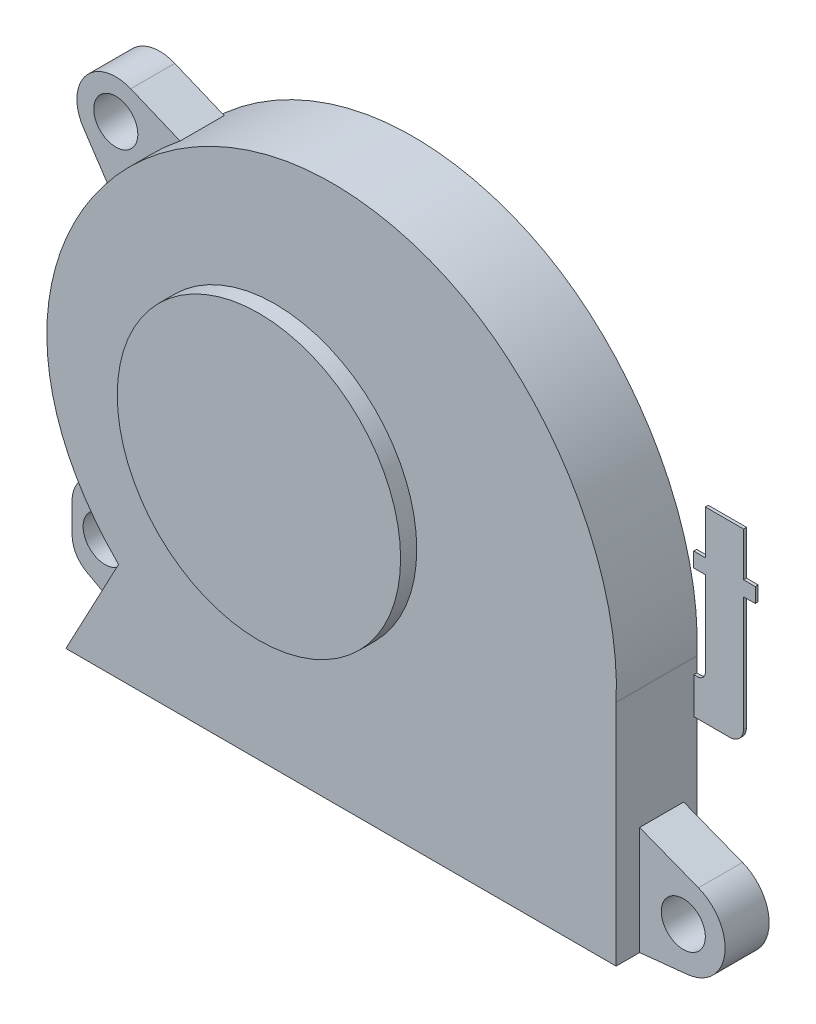
from build123d import *

# Parameters (mm, degrees)
SKIZZE1_R                       = 9.65
AUFSATZ_LINEAR_AUSTRAGEN1_DEPTH = 5.5
SKIZZE1_3_R                     = 9.65
AUFSATZ_LINEAR_AUSTRAGEN2_DEPTH = 6.6
AUFSATZ_LINEAR_START            = 0.9
SKIZZE1_5_R                     = 1.5
AUFSATZ_LINEAR_AUSTRAGEN3_DEPTH = 3
AUFSATZ_LINEAR_AUSTRAGEN4_DEPTH = 0.2


with BuildPart() as part:
    # Skizze1 → Aufsatz-Linear austragen1 (new body)
    with BuildSketch(Plane.XY):
        with BuildLine():
            Line((-14.24879669, -17.8), (23.22989124, -17.8))
            Line((23.22989124, -17.8), (23.22989124, -2.247542747))
            add(Edge.make_bspline(
                [(23.22989124, -2.247542747), (23.570505731, 5.01843493), (17.435920317, 16.509432663), (2.315543688, 19.773891452), (-13.917413027, 13.221960429), (-19.306383662, -2.33852969), (-10.663184769, -11.056444767)],
                knots=[0, 0, 0, 0, 0.303535836, 0.457029394, 0.601755461, 1, 1, 1, 1], degree=3))
            Line((-10.663184769, -11.056444767), (-14.24879669, -17.8))
        make_face()
        Circle(SKIZZE1_R, mode=Mode.SUBTRACT)
    extrude(amount=AUFSATZ_LINEAR_AUSTRAGEN1_DEPTH)

    # Skizze1<3> → Aufsatz-Linear austragen2 (add)
    with BuildSketch(Plane.XY):
        Circle(SKIZZE1_3_R)
    extrude(amount=AUFSATZ_LINEAR_AUSTRAGEN2_DEPTH)

    # Skizze1<5> → Aufsatz-Linear austragen3 (add)
    # profile 1 of 3: a face of its own
    with BuildSketch(Plane.XY.offset(AUFSATZ_LINEAR_START)):
        with BuildLine():
            Line((23.22989124, -10.418487336), (23.22989124, -17.8))
            Line((23.22989124, -17.8), (26.500672864, -17.459737855))
            ThreePointArc((26.500672864, -17.459737855), (29.026515796, -15.008489952), (27.237700891, -11.977212988))
            Line((27.237700891, -11.977212988), (23.22989124, -10.418487336))
        make_face()
        with Locations((26.206225463, -14.629352042)):
            Circle(SKIZZE1_5_R, mode=Mode.SUBTRACT)
    # profile 2 of 3: a face of its own
    with BuildSketch(Plane.XY.offset(AUFSATZ_LINEAR_START)):
        with BuildLine():
            Line((-14.434796379, -14.178445133), (-12.800547832, -15.076240045))
            Line((-12.800547832, -15.076240045), (-10.663184769, -11.056444767))
            add(Edge.make_bspline(
                [(-13.215759107, -7.863797122), (-12.531518629, -8.956537973), (-11.685451286, -10.025341262), (-10.663184769, -11.056444767)],
                knots=[0.952897988, 0.952897988, 0.952897988, 0.952897988, 1, 1, 1, 1], degree=3))
            Line((-13.215759107, -7.863797122), (-14.363260793, -8.582327138))
            ThreePointArc((-14.363260793, -8.582327138), (-15.186624929, -9.485521456), (-15.423283617, -10.684554877))
            Line((-15.423283617, -10.684554877), (-15.423283617, -12.507578786))
            ThreePointArc((-15.423283617, -12.507578786), (-15.157656262, -13.478261712), (-14.434796379, -14.178445133))
        make_face()
        with Locations((-13.17621437, -11.618483702)):
            Circle(SKIZZE1_5_R, mode=Mode.SUBTRACT)
    # profile 3 of 3: a face of its own
    with BuildSketch(Plane.XY.offset(AUFSATZ_LINEAR_START)):
        with BuildLine():
            add(Edge.make_bspline(
                [(-8.069037879, 14.42388259), (-9.937212437, 12.945618154), (-11.560246269, 11.14536638), (-12.81225318, 9.143669748)],
                knots=[0.61161883, 0.61161883, 0.61161883, 0.61161883, 0.708712293, 0.708712293, 0.708712293, 0.708712293], degree=3))
            Line((-8.069037879, 14.42388259), (-11.430379202, 15.82207236))
            ThreePointArc((-11.430379202, 15.82207236), (-14.493909546, 15.059392032), (-14.653056668, 11.90636624))
            Line((-14.653056668, 11.90636624), (-12.81225318, 9.143669748))
        make_face()
        with Locations((-12.448019378, 13.375597605)):
            Circle(SKIZZE1_5_R, mode=Mode.SUBTRACT)
    extrude(amount=AUFSATZ_LINEAR_AUSTRAGEN3_DEPTH)

    # Skizze1<6> → Aufsatz-Linear austragen4 (add)
    with BuildSketch(Plane.XY):
        with BuildLine():
            Line((23.22989124, -3.252529258), (23.22989124, -5.733420738))
            Line((23.22989124, -5.733420738), (25.665000561, -5.733420738))
            ThreePointArc((25.665000561, -5.733420738), (26.331877002, -5.457191471), (26.608106269, -4.79031503))
            Line((26.608106269, -4.79031503), (26.608106269, 3.027890879))
            Line((26.608106269, 3.027890879), (27.408106269, 3.027890879))
            Line((27.408106269, 3.027890879), (27.408106269, 4.027890879))
            Line((27.408106269, 4.027890879), (26.608106269, 4.027890879))
            Line((26.608106269, 4.027890879), (26.608106269, 7.027890879))
            Line((26.608106269, 7.027890879), (24.008106269, 7.027890879))
            Line((24.008106269, 7.027890879), (24.008106269, 4.027890879))
            Line((24.008106269, 4.027890879), (23.208106269, 4.027890879))
            Line((23.208106269, 4.027890879), (23.208106269, 3.027890879))
            Line((23.208106269, 3.027890879), (24.008106269, 3.027890879))
            Line((24.008106269, 3.027890879), (24.008106269, -2.725622817))
            ThreePointArc((24.008106269, -2.725622817), (23.853778945, -3.098201935), (23.481199827, -3.252529258))
            Line((23.481199827, -3.252529258), (23.22989124, -3.252529258))
        make_face()
    extrude(amount=AUFSATZ_LINEAR_AUSTRAGEN4_DEPTH)


solid = part.part
